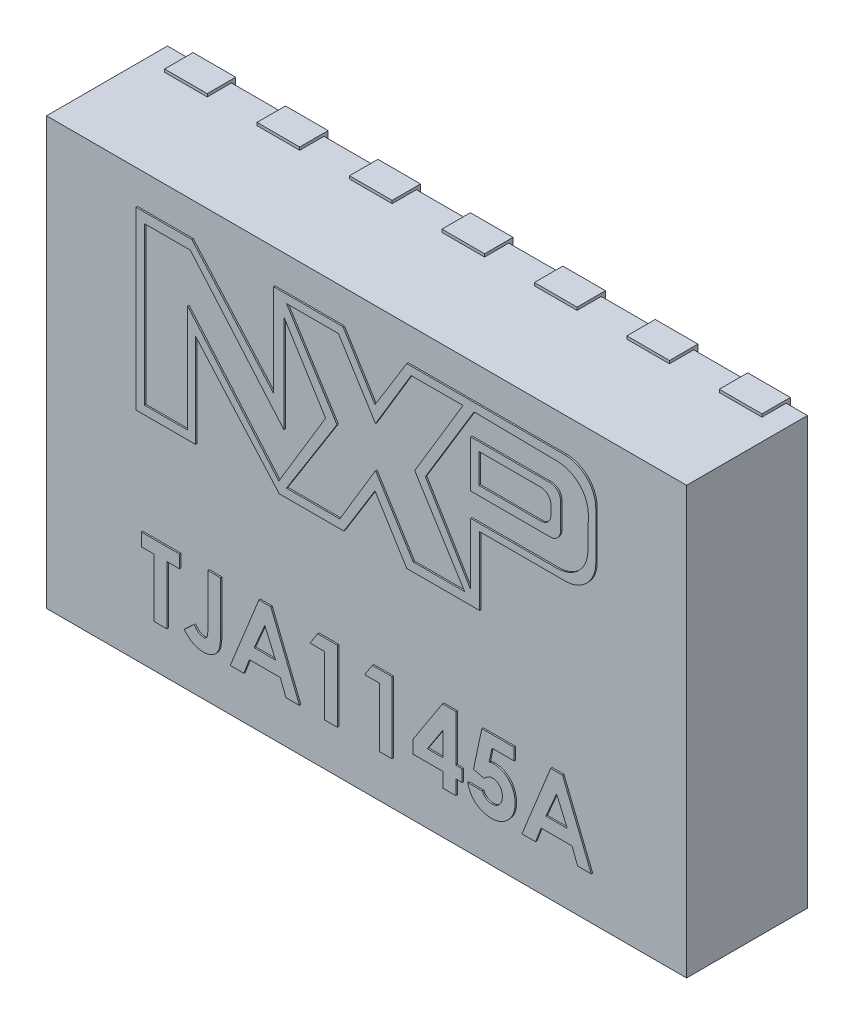
from build123d import *

# Parameters (mm, degrees)
SKETCH1_W           = 4.5
SKETCH1_H           = 3
BOSS_EXTRUDE1_DEPTH = 0.85
SKETCH2_W           = 4.2
SKETCH2_H           = 1.6
SKETCH2_W_2         = 0.3
SKETCH2_H_2         = 0.557287179
BOSS_EXTRUDE2_DEPTH = 0.03
SKETCH3_W           = 5.542428218
SKETCH3_H           = 0.402549931
SKETCH3_W_2         = 5.108551145
SKETCH3_H_2         = 0.537427481
CUT_EXTRUDE1_DEPTH  = 2.03
SKETCH4_W           = 0.3
SKETCH4_H           = 0.2
BOSS_EXTRUDE3_DEPTH = 0.02
BOSS_EXTRUDE4_DEPTH = 0.01
BOSS_EXTRUDE5_DEPTH = 0.01


with BuildPart() as part:
    # Sketch1 → Boss-Extrude1 (new body)
    with BuildSketch(Plane.XY):
        Rectangle(SKETCH1_W, SKETCH1_H)
    extrude(amount=BOSS_EXTRUDE1_DEPTH)

    # Sketch2 → Boss-Extrude2 (add)
    with BuildSketch(Plane(origin=(0, 0, 0), x_dir=(-1, 0, 0), z_dir=(0, 0, -1))):
        Rectangle(SKETCH2_W, SKETCH2_H)
        with Locations((-1.95, 1.37864359)):
            Rectangle(SKETCH2_W_2, SKETCH2_H_2)
        with Locations((-1.3, 1.37864359)):
            Rectangle(SKETCH2_W_2, SKETCH2_H_2)
        with Locations((-0.65, 1.37864359)):
            Rectangle(SKETCH2_W_2, SKETCH2_H_2)
        with Locations((0, 1.37864359)):
            Rectangle(SKETCH2_W_2, SKETCH2_H_2)
        with Locations((0.65, 1.37864359)):
            Rectangle(SKETCH2_W_2, SKETCH2_H_2)
        with Locations((1.3, 1.37864359)):
            Rectangle(SKETCH2_W_2, SKETCH2_H_2)
        with Locations((1.95, 1.37864359)):
            Rectangle(SKETCH2_W_2, SKETCH2_H_2)
        with Locations((1.95, -1.37864359)):
            Rectangle(SKETCH2_W_2, SKETCH2_H_2)
        with Locations((1.3, -1.37864359)):
            Rectangle(SKETCH2_W_2, SKETCH2_H_2)
        with Locations((0.65, -1.37864359)):
            Rectangle(SKETCH2_W_2, SKETCH2_H_2)
        with Locations((0, -1.37864359)):
            Rectangle(SKETCH2_W_2, SKETCH2_H_2)
        with Locations((-0.65, -1.37864359)):
            Rectangle(SKETCH2_W_2, SKETCH2_H_2)
        with Locations((-1.3, -1.37864359)):
            Rectangle(SKETCH2_W_2, SKETCH2_H_2)
        with Locations((-1.95, -1.37864359)):
            Rectangle(SKETCH2_W_2, SKETCH2_H_2)
    extrude(amount=BOSS_EXTRUDE2_DEPTH)

    # Sketch3 → Cut-Extrude1 (cut)
    with BuildSketch(Plane.XY.offset(0.85)):
        with Locations((0.521214109, 1.701274966)):
            Rectangle(SKETCH3_W, SKETCH3_H)
        with Locations((0.304275573, -1.76871374)):
            Rectangle(SKETCH3_W_2, SKETCH3_H_2)
    extrude(amount=-CUT_EXTRUDE1_DEPTH, mode=Mode.SUBTRACT)

    # Sketch4 → Boss-Extrude3 (add)
    with BuildSketch(Plane.XZ.offset(1.5)):
        with Locations((-1.95, 0.07)):
            Rectangle(SKETCH4_W, SKETCH4_H)
        with Locations((-1.3, 0.07)):
            Rectangle(SKETCH4_W, SKETCH4_H)
        with Locations((-0.65, 0.07)):
            Rectangle(SKETCH4_W, SKETCH4_H)
        with Locations((0, 0.07)):
            Rectangle(SKETCH4_W, SKETCH4_H)
        with Locations((0.65, 0.07)):
            Rectangle(SKETCH4_W, SKETCH4_H)
        with Locations((1.3, 0.07)):
            Rectangle(SKETCH4_W, SKETCH4_H)
        with Locations((1.95, 0.07)):
            Rectangle(SKETCH4_W, SKETCH4_H)
    boss_extrude3 = extrude(amount=BOSS_EXTRUDE3_DEPTH)

    # Mirror1: Boss-Extrude3 across plane
    add(boss_extrude3.mirror(Plane.ZX))

    # Sketch8 → Boss-Extrude4 (add)
    # profile 1 of 2: a face of its own
    with BuildSketch(Plane.XY.offset(0.85)):
        with BuildLine():
            Line((-1.218559147, 1.267877009), (-0.644660909, 0.618874845))
            Line((-0.644660909, 0.618874845), (-0.644660909, 1.267877009))
            Line((-0.644660909, 1.267877009), (-0.155544183, 1.267877009))
            Line((-0.155544183, 1.267877009), (0.069183646, 0.905578427))
            Line((0.069183646, 0.905578427), (0.292952543, 1.267877009))
            Line((0.292952543, 1.267877009), (1.405698433, 1.267877009))
            ThreePointArc((1.405698433, 1.267877009), (1.558433498, 1.204612074), (1.621698433, 1.051877009))
            Line((1.621698433, 1.051877009), (1.621698433, 0.716280897))
            ThreePointArc((1.621698433, 0.716280897), (1.558433498, 0.563545832), (1.405698433, 0.500280897))
            Line((1.405698433, 0.500280897), (0.805434822, 0.500280897))
            Line((0.805434822, 0.500280897), (0.805434822, 0.020247185))
            Line((0.805434822, 0.020247185), (0.292952543, 0.020247185))
            Line((0.292952543, 0.020247185), (0.069183646, 0.38099981))
            Line((0.069183646, 0.38099981), (-0.149697341, 0.02661512))
            Line((-0.149697341, 0.02661512), (-0.603870765, 0.02661512))
            Line((-0.603870765, 0.02661512), (-1.192061741, 0.691780461))
            Line((-1.192061741, 0.691780461), (-1.192061741, 0.032897543))
            Line((-1.192061741, 0.032897543), (-1.611137286, 0.032897543))
            Line((-1.611137286, 0.032897543), (-1.611137286, 1.267877009))
            Line((-1.611137286, 1.267877009), (-1.218559147, 1.267877009))
        make_face()
        Polygon((-0.553231932, 1.210312598), (-0.188037013, 1.210312598), (0.073077476, 0.79234991), (0.323648792, 1.210312598), (0.688184293, 1.210312598), (0.348798025, 0.644203119), (0.699760653, 0.08242164), (0.337615575, 0.08242164), (0.073077476, 0.505864459), (-0.178605926, 0.086046767), (-0.553231932, 0.086046767), (-0.198118064, 0.650042618), align=None, mode=Mode.SUBTRACT)
        with BuildLine():
            Line((0.766182701, 1.210312598), (1.356373147, 1.202040737))
            ThreePointArc((1.356373147, 1.202040737), (1.508206605, 1.136641555), (1.569324867, 0.983034882))
            Line((1.569324867, 0.983034882), (1.566236946, 0.762714247))
            ThreePointArc((1.566236946, 0.762714247), (1.501919217, 0.611939743), (1.350258158, 0.549741315))
            Line((1.350258158, 0.549741315), (0.741987684, 0.549741315))
            Line((0.741987684, 0.549741315), (0.741987684, 0.115644305))
            Line((0.741987684, 0.115644305), (0.423296465, 0.644203119))
            Line((0.423296465, 0.644203119), (0.766182701, 1.210312598))
        make_face(mode=Mode.SUBTRACT)
        Polygon((-1.552044791, 0.09243378), (-1.552044791, 1.197500136), (-1.229122452, 1.197500136), (-0.571417002, 0.433439095), (-0.571417002, 1.120265885), (-0.27795521, 0.650042618), (-0.606889936, 0.102651869), (-1.247993344, 0.847426201), (-1.247993344, 0.09243378), align=None, mode=Mode.SUBTRACT)
    # profile 2 of 2: a face of its own
    with BuildSketch(Plane.XY.offset(0.85)):
        with BuildLine():
            Line((0.741987684, 1.046016424), (0.741987684, 0.716280897))
            Line((0.741987684, 0.716280897), (1.301592263, 0.716280897))
            ThreePointArc((1.301592263, 0.716280897), (1.352503951, 0.737369209), (1.373592263, 0.788280897))
            Line((1.373592263, 0.788280897), (1.373592263, 0.974016424))
            ThreePointArc((1.373592263, 0.974016424), (1.352503951, 1.024928112), (1.301592263, 1.046016424))
            Line((1.301592263, 1.046016424), (0.741987684, 1.046016424))
        make_face()
        with BuildLine():
            Line((0.79982972, 0.986259174), (1.234333614, 0.986259174))
            ThreePointArc((1.234333614, 0.986259174), (1.285245302, 0.965170862), (1.306333614, 0.914259174))
            Line((1.306333614, 0.914259174), (1.306333614, 0.851953508))
            ThreePointArc((1.306333614, 0.851953508), (1.285245302, 0.801041819), (1.234333614, 0.779953508))
            Line((1.234333614, 0.779953508), (0.79982972, 0.779953508))
            Line((0.79982972, 0.779953508), (0.79982972, 0.986259174))
        make_face(mode=Mode.SUBTRACT)
    extrude(amount=BOSS_EXTRUDE4_DEPTH)

    # Sketch9 → Boss-Extrude5 (add)
    # profile 1 of 8: a face of its own
    with BuildSketch(Plane.XY.offset(0.85)):
        Polygon((-1.573632926, -0.691089079), (-1.304402157, -0.691089079), (-1.304402157, -0.780832669), (-1.394145747, -0.780832669), (-1.394145747, -1.191089079), (-1.483889336, -1.191089079), (-1.483889336, -0.780832669), (-1.573632926, -0.780832669), align=None)
    # profile 2 of 8: a face of its own
    with BuildSketch(Plane.XY.offset(0.85)):
        with BuildLine():
            Line((-1.105684208, -0.691089079), (-1.015940618, -0.691089079))
            Line((-1.015940618, -0.691089079), (-1.015940618, -1.023020169))
            add(Edge.make_bspline(
                [(-1.015940618, -1.023020169), (-1.015973521, -1.02936427), (-1.016036918, -1.041588099), (-1.016671634, -1.059185902), (-1.017529883, -1.07532046), (-1.018765843, -1.089965922), (-1.020601583, -1.103121579), (-1.022679083, -1.114820253), (-1.024971143, -1.125109613), (-1.028842993, -1.136625008), (-1.034853929, -1.149376998), (-1.043924603, -1.163150959), (-1.055220495, -1.175118184), (-1.068229632, -1.185513103), (-1.083061624, -1.193743912), (-1.099374778, -1.199693163), (-1.117116945, -1.203247286), (-1.129405627, -1.203684499), (-1.135732285, -1.203909592)],
                knots=[0, 0, 0, 0, 1.22248561, 2.355488409, 3.392943897, 4.335991845, 5.186735882, 5.951517034, 6.625683685, 7.215700098, 8.28923535, 9.333114649, 10.380102123, 11.447198135, 12.530158036, 13.633358744, 14.781567393, 16, 16, 16, 16], degree=3))
            add(Edge.make_bspline(
                [(-1.135732285, -1.203909592), (-1.142324087, -1.203705518), (-1.155325695, -1.203303003), (-1.174393892, -1.19987461), (-1.192720813, -1.194377865), (-1.210211644, -1.186430232), (-1.227106015, -1.176474747), (-1.243097308, -1.164125937), (-1.2585194, -1.149766793), (-1.26766171, -1.138747946), (-1.272350875, -1.133096291)],
                knots=[0, 0, 0, 0, 0.990984786, 1.954608977, 2.90473533, 3.862451285, 4.837525908, 5.848096122, 6.896271184, 8, 8, 8, 8], degree=3))
            Line((-1.272350875, -1.133096291), (-1.204442221, -1.07029581))
            add(Edge.make_bspline(
                [(-1.204442221, -1.07029581), (-1.2008866, -1.074316213), (-1.194233079, -1.081839467), (-1.184206417, -1.091649975), (-1.175161829, -1.099531586), (-1.166635775, -1.105216663), (-1.158589943, -1.109224008), (-1.150851221, -1.112110611), (-1.143178381, -1.113744592), (-1.138109469, -1.114027658), (-1.135632125, -1.114166002)],
                knots=[0, 0, 0, 0, 1.529509877, 2.862124173, 3.996688592, 4.944357383, 5.774364335, 6.554177287, 7.293378699, 8, 8, 8, 8], degree=3))
            add(Edge.make_bspline(
                [(-1.135632125, -1.114166002), (-1.133234331, -1.114040961), (-1.128624162, -1.113800548), (-1.122285002, -1.111128054), (-1.116940682, -1.106932126), (-1.113422298, -1.102108362), (-1.111180156, -1.097177177), (-1.109779223, -1.092410428), (-1.108449736, -1.086696388), (-1.10738458, -1.080037921), (-1.106579746, -1.072348176), (-1.106178595, -1.063720506), (-1.105690743, -1.054108289), (-1.105686464, -1.047393321), (-1.105684208, -1.043853502)],
                knots=[0, 0, 0, 0, 1.003927327, 1.930222208, 2.840933547, 3.835773585, 4.407906147, 5.114514582, 5.922289074, 6.876303333, 7.950072246, 9.174518422, 10.510537432, 12, 12, 12, 12], degree=3))
            Line((-1.105684208, -1.043853502), (-1.105684208, -0.691089079))
        make_face()
    # profile 3 of 8: a face of its own
    with BuildSketch(Plane.XY.offset(0.85)):
        Polygon((-0.746609689, -0.691089079), (-0.663376516, -0.691089079), (-0.461453439, -1.191089079), (-0.557306804, -1.191089079), (-0.596168984, -1.088524977), (-0.814017541, -1.088524977), (-0.852879721, -1.191089079), (-0.948632926, -1.191089079), align=None)
        Polygon((-0.705043182, -0.825203663), (-0.779963054, -0.998781387), (-0.630123311, -0.998781387), align=None, mode=Mode.SUBTRACT)
    # profile 4 of 8: a face of its own
    with BuildSketch(Plane.XY.offset(0.85)):
        Polygon((-0.334149753, -0.691089079), (-0.195427798, -0.691089079), (-0.195427798, -1.191089079), (-0.285171388, -1.191089079), (-0.285171388, -0.774422413), (-0.38773549, -0.774422413), align=None)
    # profile 5 of 8: a face of its own
    with BuildSketch(Plane.XY.offset(0.85)):
        Polygon((0.050465632, -0.691089079), (0.189187587, -0.691089079), (0.189187587, -1.191089079), (0.099443997, -1.191089079), (0.099443997, -0.774422413), (-0.003120105, -0.774422413), align=None)
    # profile 6 of 8: a face of its own
    with BuildSketch(Plane.XY.offset(0.85)):
        Polygon((0.544355856, -0.678268567), (0.637905536, -0.678268567), (0.637905536, -1.005191643), (0.68277733, -1.005191643), (0.68277733, -1.088524977), (0.637905536, -1.088524977), (0.637905536, -1.191089079), (0.548161946, -1.191089079), (0.548161946, -1.088524977), (0.336623484, -1.088524977), (0.336623484, -0.997679624), align=None)
        Polygon((0.548161946, -1.005191643), (0.548161946, -0.835019368), (0.437484862, -1.005191643), align=None, mode=Mode.SUBTRACT)
    # profile 7 of 8: a face of its own
    with BuildSketch(Plane.XY.offset(0.85)):
        with BuildLine():
            Line((0.820497683, -0.691089079), (1.048161946, -0.691089079))
            Line((1.048161946, -0.691089079), (1.048161946, -0.774422413))
            Line((1.048161946, -0.774422413), (0.891611465, -0.774422413))
            Line((0.891611465, -0.774422413), (0.872080215, -0.868973695))
            add(Edge.make_bspline(
                [(0.872080215, -0.868973695), (0.874741627, -0.868232458), (0.879990479, -0.866770586), (0.887897882, -0.865304514), (0.895561256, -0.864354253), (0.900589916, -0.8642275), (0.903029734, -0.864166002)],
                knots=[0, 0, 0, 0, 1.05461699, 2.079921384, 3.068411212, 4, 4, 4, 4], degree=3))
            add(Edge.make_bspline(
                [(0.903029734, -0.864166002), (0.908346354, -0.86428783), (0.918826583, -0.864527978), (0.934157827, -0.866807769), (0.948838399, -0.870398372), (0.962823375, -0.875519311), (0.976099094, -0.882184346), (0.988681647, -0.89024717), (1.000586478, -0.899721945), (1.011602107, -0.910614601), (1.021723727, -0.922574985), (1.030523898, -0.935511406), (1.038039794, -0.949239402), (1.044017677, -0.963844308), (1.048735933, -0.979234394), (1.052145449, -0.995419522), (1.054161667, -1.012418875), (1.054433541, -1.024016319), (1.054572202, -1.029931227)],
                knots=[0, 0, 0, 0, 1.01440847, 1.999622559, 2.951875003, 3.895578053, 4.836219714, 5.782137149, 6.743708247, 7.735272588, 8.734977101, 9.730283169, 10.717124674, 11.717316708, 12.737475749, 13.78628267, 14.87096371, 16, 16, 16, 16], degree=3))
            add(Edge.make_bspline(
                [(1.054572202, -1.029931227), (1.054402756, -1.035913283), (1.05406839, -1.047717628), (1.051886955, -1.06507419), (1.048036684, -1.081697859), (1.042747951, -1.097633135), (1.035780385, -1.112762897), (1.027400932, -1.12724388), (1.01746792, -1.140968594), (1.006078824, -1.153796346), (0.993697384, -1.165521157), (0.980514072, -1.175835496), (0.966621506, -1.184514929), (0.952019351, -1.191529378), (0.936791384, -1.197079085), (0.920932983, -1.201119007), (0.904367078, -1.203435678), (0.893120981, -1.203749885), (0.887404734, -1.203909592)],
                knots=[0, 0, 0, 0, 1.06808661, 2.107647099, 3.116961351, 4.110378221, 5.100014249, 6.085620622, 7.093190682, 8.119403071, 9.144090782, 10.133780668, 11.103064255, 12.062861538, 13.020824475, 13.992378307, 14.979551724, 16, 16, 16, 16], degree=3))
            add(Edge.make_bspline(
                [(0.887404734, -1.203909592), (0.882292865, -1.203778942), (0.87221119, -1.203521271), (0.857361324, -1.201937495), (0.843044405, -1.199137362), (0.829336439, -1.195084846), (0.816093195, -1.190097124), (0.80346777, -1.183859034), (0.791390784, -1.176489359), (0.779896531, -1.168122596), (0.769171778, -1.158697761), (0.759383359, -1.148380656), (0.750472015, -1.137301321), (0.742628434, -1.125323073), (0.735877204, -1.112463609), (0.729890076, -1.098874479), (0.724989551, -1.08441377), (0.722502676, -1.074388803), (0.721238869, -1.069294208)],
                knots=[0, 0, 0, 0, 1.054957082, 2.080596141, 3.077793124, 4.061112343, 5.027190972, 5.994718051, 6.962465889, 7.943658696, 8.924948258, 9.904494768, 10.875059, 11.855380583, 12.854004648, 13.869083016, 14.917087635, 16, 16, 16, 16], degree=3))
            Line((0.721238869, -1.069294208), (0.823802971, -1.069294208))
            add(Edge.make_bspline(
                [(0.823802971, -1.069294208), (0.825677846, -1.072824555), (0.82932145, -1.079685382), (0.836252391, -1.088794161), (0.844011139, -1.096561736), (0.852527706, -1.103063999), (0.861857275, -1.107935384), (0.871619682, -1.111629616), (0.88193757, -1.113764376), (0.888964507, -1.114031243), (0.892512907, -1.114166002)],
                knots=[0, 0, 0, 0, 1.104910296, 2.147267069, 3.153527244, 4.136738762, 5.099945312, 6.05603338, 7.018353, 8, 8, 8, 8], degree=3))
            add(Edge.make_bspline(
                [(0.892512907, -1.114166002), (0.894986095, -1.11407295), (0.899852133, -1.113889867), (0.90702147, -1.112921312), (0.913864917, -1.111086892), (0.920433354, -1.108546647), (0.926744425, -1.105378674), (0.932707659, -1.101379315), (0.938426805, -1.096775904), (0.943814794, -1.091493475), (0.948694759, -1.085604795), (0.952973955, -1.079277007), (0.956800146, -1.072650715), (0.959634264, -1.065463436), (0.961955168, -1.057929785), (0.963664375, -1.049992932), (0.964685819, -1.041643609), (0.964780377, -1.03594376), (0.964828612, -1.033036195)],
                knots=[0, 0, 0, 0, 0.978869489, 1.925942215, 2.855067702, 3.774946051, 4.70828698, 5.642468714, 6.60995405, 7.609372294, 8.622401667, 9.629904756, 10.629323, 11.642352373, 12.678539694, 13.745912462, 14.850161547, 16, 16, 16, 16], degree=3))
            add(Edge.make_bspline(
                [(0.964828612, -1.033036195), (0.96477263, -1.030196121), (0.964663658, -1.024667849), (0.963762221, -1.016550365), (0.962149567, -1.008848341), (0.959952313, -1.001502787), (0.957139566, -0.994558308), (0.9537022, -0.987973566), (0.949625532, -0.981781846), (0.944887674, -0.976109204), (0.939835272, -0.970906096), (0.934407368, -0.966355499), (0.928652865, -0.962578819), (0.922750577, -0.959281668), (0.916464907, -0.956882074), (0.909937194, -0.955229561), (0.903174302, -0.954017014), (0.89856148, -0.953945773), (0.896218837, -0.953909592)],
                knots=[0, 0, 0, 0, 1.166249705, 2.270133367, 3.348514167, 4.393962215, 5.415026464, 6.420877785, 7.440098956, 8.453121383, 9.451844239, 10.415694839, 11.355045125, 12.27538808, 13.187007209, 14.108269027, 15.039275622, 16, 16, 16, 16], degree=3))
            add(Edge.make_bspline(
                [(0.896218837, -0.953909592), (0.893674182, -0.954006148), (0.888574148, -0.954199666), (0.880996774, -0.95577427), (0.873510761, -0.95832257), (0.866074481, -0.961838353), (0.858761751, -0.966439404), (0.851379585, -0.97183591), (0.844175079, -0.978419978), (0.839594254, -0.983323806), (0.837224446, -0.985860714)],
                knots=[0, 0, 0, 0, 0.88288272, 1.769486374, 2.674910571, 3.623812639, 4.617874466, 5.670434592, 6.794841017, 8, 8, 8, 8], degree=3))
            Line((0.837224446, -0.985860714), (0.761703612, -0.96853299))
            Line((0.761703612, -0.96853299), (0.820497683, -0.691089079))
        make_face()
    # profile 8 of 8: a face of its own
    with BuildSketch(Plane.XY.offset(0.85)):
        Polygon((1.304672362, -0.691089079), (1.387905536, -0.691089079), (1.589828612, -1.191089079), (1.493975247, -1.191089079), (1.455113068, -1.088524977), (1.23726451, -1.088524977), (1.19840233, -1.191089079), (1.102649125, -1.191089079), align=None)
        Polygon((1.346238869, -0.825203663), (1.271318997, -0.998781387), (1.421158741, -0.998781387), align=None, mode=Mode.SUBTRACT)
    extrude(amount=BOSS_EXTRUDE5_DEPTH)


solid = part.part
